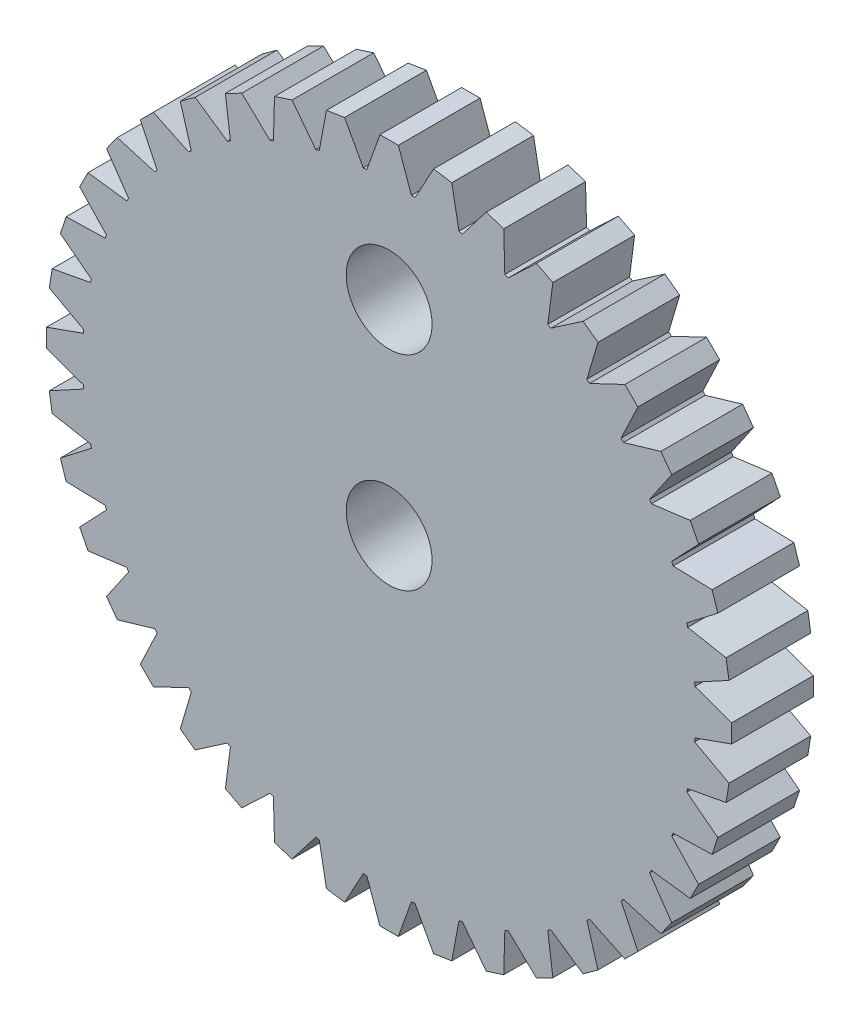
from build123d import *

# Parameters (mm, degrees)
BOSS_EXTRUDE5_DEPTH = 2
SKETCH8_R           = 1.05
CUT_EXTRUDE2_DEPTH  = 13.018925478


with BuildPart() as part:
    # Sketch7 → Boss-Extrude5 (new body)
    with BuildSketch(Plane.XY):
        with BuildLine():
            Line((-0.225, 8.380172124), (0.225, 8.380172124))
            Line((0.225, 8.380172124), (0.545, 7.480172124))
            ThreePointArc((0.545, 7.480172124), (0.588443218, 7.476880003), (0.631866579, 7.473335576))
            Line((0.631866579, 7.473335576), (1.088717866, 8.312196053))
            Line((1.088717866, 8.312196053), (1.53317762, 8.241800544))
            Line((1.53317762, 8.241800544), (1.70844687, 7.302822009))
            ThreePointArc((1.70844687, 7.302822009), (1.750840229, 7.292774403), (1.793174506, 7.282480703))
            Line((1.793174506, 7.282480703), (2.375627886, 8.03954613))
            Line((2.375627886, 8.03954613), (2.803603318, 7.900488482))
            Line((2.803603318, 7.900488482), (2.829826108, 6.945652179))
            ThreePointArc((2.829826108, 6.945652179), (2.870125743, 6.929096494), (2.910328525, 6.912306987))
            Line((2.910328525, 6.912306987), (3.604042062, 7.568935898))
            Line((3.604042062, 7.568935898), (4.004994998, 7.364640174))
            Line((4.004994998, 7.364640174), (3.881525636, 6.417457342))
            ThreePointArc((3.881525636, 6.417457342), (3.918739235, 6.394801233), (3.955820597, 6.371929331))
            Line((3.955820597, 6.371929331), (4.743712762, 6.911953346))
            Line((4.743712762, 6.911953346), (5.10777041, 6.647449982))
            Line((5.10777041, 6.647449982), (4.837649121, 5.731243406))
            ThreePointArc((4.837649121, 5.731243406), (4.870860362, 5.703044742), (4.903907237, 5.674653629))
            Line((4.903907237, 5.674653629), (5.76657751, 6.084775562))
            Line((5.76657751, 6.084775562), (6.084775562, 5.76657751))
            Line((6.084775562, 5.76657751), (5.674653629, 4.903907237))
            ThreePointArc((5.674653629, 4.903907237), (5.703044742, 4.870860362), (5.731243406, 4.837649121))
            Line((5.731243406, 4.837649121), (6.647449982, 5.10777041))
            Line((6.647449982, 5.10777041), (6.911953346, 4.743712762))
            Line((6.911953346, 4.743712762), (6.371929331, 3.955820597))
            ThreePointArc((6.371929331, 3.955820597), (6.394801233, 3.918739235), (6.417457342, 3.881525636))
            Line((6.417457342, 3.881525636), (7.364640174, 4.004994998))
            Line((7.364640174, 4.004994998), (7.568935898, 3.604042062))
            Line((7.568935898, 3.604042062), (6.912306987, 2.910328525))
            ThreePointArc((6.912306987, 2.910328525), (6.929096494, 2.870125743), (6.945652179, 2.829826108))
            Line((6.945652179, 2.829826108), (7.900488482, 2.803603318))
            Line((7.900488482, 2.803603318), (8.03954613, 2.375627886))
            Line((8.03954613, 2.375627886), (7.282480703, 1.793174506))
            ThreePointArc((7.282480703, 1.793174506), (7.292774403, 1.750840229), (7.302822009, 1.70844687))
            Line((7.302822009, 1.70844687), (8.241800544, 1.53317762))
            Line((8.241800544, 1.53317762), (8.312196053, 1.088717866))
            Line((8.312196053, 1.088717866), (7.473335576, 0.631866579))
            ThreePointArc((7.473335576, 0.631866579), (7.476880003, 0.588443218), (7.480172124, 0.545))
            Line((7.480172124, 0.545), (8.380172124, 0.225))
            Line((8.380172124, 0.225), (8.380172124, -0.225))
            Line((8.380172124, -0.225), (7.480172124, -0.545))
            ThreePointArc((7.480172124, -0.545), (7.476880003, -0.588443218), (7.473335576, -0.631866579))
            Line((7.473335576, -0.631866579), (8.312196053, -1.088717866))
            Line((8.312196053, -1.088717866), (8.241800544, -1.53317762))
            Line((8.241800544, -1.53317762), (7.302822009, -1.70844687))
            ThreePointArc((7.302822009, -1.70844687), (7.292774403, -1.750840229), (7.282480703, -1.793174506))
            Line((7.282480703, -1.793174506), (8.03954613, -2.375627886))
            Line((8.03954613, -2.375627886), (7.900488482, -2.803603318))
            Line((7.900488482, -2.803603318), (6.945652179, -2.829826108))
            ThreePointArc((6.945652179, -2.829826108), (6.929096494, -2.870125743), (6.912306987, -2.910328525))
            Line((6.912306987, -2.910328525), (7.568935898, -3.604042062))
            Line((7.568935898, -3.604042062), (7.364640174, -4.004994998))
            Line((7.364640174, -4.004994998), (6.417457342, -3.881525636))
            ThreePointArc((6.417457342, -3.881525636), (6.394801233, -3.918739235), (6.371929331, -3.955820597))
            Line((6.371929331, -3.955820597), (6.911953346, -4.743712762))
            Line((6.911953346, -4.743712762), (6.647449982, -5.10777041))
            Line((6.647449982, -5.10777041), (5.731243406, -4.837649121))
            ThreePointArc((5.731243406, -4.837649121), (5.703044742, -4.870860362), (5.674653629, -4.903907237))
            Line((5.674653629, -4.903907237), (6.084775562, -5.76657751))
            Line((6.084775562, -5.76657751), (5.76657751, -6.084775562))
            Line((5.76657751, -6.084775562), (4.903907237, -5.674653629))
            ThreePointArc((4.903907237, -5.674653629), (4.870860362, -5.703044742), (4.837649121, -5.731243406))
            Line((4.837649121, -5.731243406), (5.10777041, -6.647449982))
            Line((5.10777041, -6.647449982), (4.743712762, -6.911953346))
            Line((4.743712762, -6.911953346), (3.955820597, -6.371929331))
            ThreePointArc((3.955820597, -6.371929331), (3.918739235, -6.394801233), (3.881525636, -6.417457342))
            Line((3.881525636, -6.417457342), (4.004994998, -7.364640174))
            Line((4.004994998, -7.364640174), (3.604042062, -7.568935898))
            Line((3.604042062, -7.568935898), (2.910328525, -6.912306987))
            ThreePointArc((2.910328525, -6.912306987), (2.870125743, -6.929096494), (2.829826108, -6.945652179))
            Line((2.829826108, -6.945652179), (2.803603318, -7.900488482))
            Line((2.803603318, -7.900488482), (2.375627886, -8.03954613))
            Line((2.375627886, -8.03954613), (1.793174506, -7.282480703))
            ThreePointArc((1.793174506, -7.282480703), (1.750840229, -7.292774403), (1.70844687, -7.302822009))
            Line((1.70844687, -7.302822009), (1.53317762, -8.241800544))
            Line((1.53317762, -8.241800544), (1.088717866, -8.312196053))
            Line((1.088717866, -8.312196053), (0.631866579, -7.473335576))
            ThreePointArc((0.631866579, -7.473335576), (0.588443218, -7.476880003), (0.545, -7.480172124))
            Line((0.545, -7.480172124), (0.225, -8.380172124))
            Line((0.225, -8.380172124), (-0.225, -8.380172124))
            Line((-0.225, -8.380172124), (-0.545, -7.480172124))
            ThreePointArc((-0.545, -7.480172124), (-0.588443218, -7.476880003), (-0.631866579, -7.473335576))
            Line((-0.631866579, -7.473335576), (-1.088717866, -8.312196053))
            Line((-1.088717866, -8.312196053), (-1.53317762, -8.241800544))
            Line((-1.53317762, -8.241800544), (-1.70844687, -7.302822009))
            ThreePointArc((-1.70844687, -7.302822009), (-1.750840229, -7.292774403), (-1.793174506, -7.282480703))
            Line((-1.793174506, -7.282480703), (-2.375627886, -8.03954613))
            Line((-2.375627886, -8.03954613), (-2.803603318, -7.900488482))
            Line((-2.803603318, -7.900488482), (-2.829826108, -6.945652179))
            ThreePointArc((-2.829826108, -6.945652179), (-2.870125743, -6.929096494), (-2.910328525, -6.912306987))
            Line((-2.910328525, -6.912306987), (-3.604042062, -7.568935898))
            Line((-3.604042062, -7.568935898), (-4.004994998, -7.364640174))
            Line((-4.004994998, -7.364640174), (-3.881525636, -6.417457342))
            ThreePointArc((-3.881525636, -6.417457342), (-3.918739235, -6.394801233), (-3.955820597, -6.371929331))
            Line((-3.955820597, -6.371929331), (-4.743712762, -6.911953346))
            Line((-4.743712762, -6.911953346), (-5.10777041, -6.647449982))
            Line((-5.10777041, -6.647449982), (-4.837649121, -5.731243406))
            ThreePointArc((-4.837649121, -5.731243406), (-4.870860362, -5.703044742), (-4.903907237, -5.674653629))
            Line((-4.903907237, -5.674653629), (-5.76657751, -6.084775562))
            Line((-5.76657751, -6.084775562), (-6.084775562, -5.76657751))
            Line((-6.084775562, -5.76657751), (-5.674653629, -4.903907237))
            ThreePointArc((-5.674653629, -4.903907237), (-5.703044742, -4.870860362), (-5.731243406, -4.837649121))
            Line((-5.731243406, -4.837649121), (-6.647449982, -5.10777041))
            Line((-6.647449982, -5.10777041), (-6.911953346, -4.743712762))
            Line((-6.911953346, -4.743712762), (-6.371929331, -3.955820597))
            ThreePointArc((-6.371929331, -3.955820597), (-6.394801233, -3.918739235), (-6.417457342, -3.881525636))
            Line((-6.417457342, -3.881525636), (-7.364640174, -4.004994998))
            Line((-7.364640174, -4.004994998), (-7.568935898, -3.604042062))
            Line((-7.568935898, -3.604042062), (-6.912306987, -2.910328525))
            ThreePointArc((-6.912306987, -2.910328525), (-6.929096494, -2.870125743), (-6.945652179, -2.829826108))
            Line((-6.945652179, -2.829826108), (-7.900488482, -2.803603318))
            Line((-7.900488482, -2.803603318), (-8.03954613, -2.375627886))
            Line((-8.03954613, -2.375627886), (-7.282480703, -1.793174506))
            ThreePointArc((-7.282480703, -1.793174506), (-7.292774403, -1.750840229), (-7.302822009, -1.70844687))
            Line((-7.302822009, -1.70844687), (-8.241800544, -1.53317762))
            Line((-8.241800544, -1.53317762), (-8.312196053, -1.088717866))
            Line((-8.312196053, -1.088717866), (-7.473335576, -0.631866579))
            ThreePointArc((-7.473335576, -0.631866579), (-7.476880003, -0.588443218), (-7.480172124, -0.545))
            Line((-7.480172124, -0.545), (-8.380172124, -0.225))
            Line((-8.380172124, -0.225), (-8.380172124, 0.225))
            Line((-8.380172124, 0.225), (-7.480172124, 0.545))
            ThreePointArc((-7.480172124, 0.545), (-7.476880003, 0.588443218), (-7.473335576, 0.631866579))
            Line((-7.473335576, 0.631866579), (-8.312196053, 1.088717866))
            Line((-8.312196053, 1.088717866), (-8.241800544, 1.53317762))
            Line((-8.241800544, 1.53317762), (-7.302822009, 1.70844687))
            ThreePointArc((-7.302822009, 1.70844687), (-7.292774403, 1.750840229), (-7.282480703, 1.793174506))
            Line((-7.282480703, 1.793174506), (-8.03954613, 2.375627886))
            Line((-8.03954613, 2.375627886), (-7.900488482, 2.803603318))
            Line((-7.900488482, 2.803603318), (-6.945652179, 2.829826108))
            ThreePointArc((-6.945652179, 2.829826108), (-6.929096494, 2.870125743), (-6.912306987, 2.910328525))
            Line((-6.912306987, 2.910328525), (-7.568935898, 3.604042062))
            Line((-7.568935898, 3.604042062), (-7.364640174, 4.004994998))
            Line((-7.364640174, 4.004994998), (-6.417457342, 3.881525636))
            ThreePointArc((-6.417457342, 3.881525636), (-6.394801233, 3.918739235), (-6.371929331, 3.955820597))
            Line((-6.371929331, 3.955820597), (-6.911953346, 4.743712762))
            Line((-6.911953346, 4.743712762), (-6.647449982, 5.10777041))
            Line((-6.647449982, 5.10777041), (-5.731243406, 4.837649121))
            ThreePointArc((-5.731243406, 4.837649121), (-5.703044742, 4.870860362), (-5.674653629, 4.903907237))
            Line((-5.674653629, 4.903907237), (-6.084775562, 5.76657751))
            Line((-6.084775562, 5.76657751), (-5.76657751, 6.084775562))
            Line((-5.76657751, 6.084775562), (-4.903907237, 5.674653629))
            ThreePointArc((-4.903907237, 5.674653629), (-4.870860362, 5.703044742), (-4.837649121, 5.731243406))
            Line((-4.837649121, 5.731243406), (-5.10777041, 6.647449982))
            Line((-5.10777041, 6.647449982), (-4.743712762, 6.911953346))
            Line((-4.743712762, 6.911953346), (-3.955820597, 6.371929331))
            ThreePointArc((-3.955820597, 6.371929331), (-3.918739235, 6.394801233), (-3.881525636, 6.417457342))
            Line((-3.881525636, 6.417457342), (-4.004994998, 7.364640174))
            Line((-4.004994998, 7.364640174), (-3.604042062, 7.568935898))
            Line((-3.604042062, 7.568935898), (-2.910328525, 6.912306987))
            ThreePointArc((-2.910328525, 6.912306987), (-2.870125743, 6.929096494), (-2.829826108, 6.945652179))
            Line((-2.829826108, 6.945652179), (-2.803603318, 7.900488482))
            Line((-2.803603318, 7.900488482), (-2.375627886, 8.03954613))
            Line((-2.375627886, 8.03954613), (-1.793174506, 7.282480703))
            ThreePointArc((-1.793174506, 7.282480703), (-1.750840229, 7.292774403), (-1.70844687, 7.302822009))
            Line((-1.70844687, 7.302822009), (-1.53317762, 8.241800544))
            Line((-1.53317762, 8.241800544), (-1.088717866, 8.312196053))
            Line((-1.088717866, 8.312196053), (-0.631866579, 7.473335576))
            ThreePointArc((-0.631866579, 7.473335576), (-0.588443218, 7.476880003), (-0.545, 7.480172124))
            Line((-0.545, 7.480172124), (-0.225, 8.380172124))
        make_face()
    extrude(amount=BOSS_EXTRUDE5_DEPTH)

    # Sketch8 → Cut-Extrude2 (cut, through all)
    with BuildSketch(Plane.XY.offset(2)):
        with Locations((0, 5)):
            Circle(SKETCH8_R)
        Circle(SKETCH8_R)
    extrude(amount=-CUT_EXTRUDE2_DEPTH, mode=Mode.SUBTRACT)


solid = part.part
